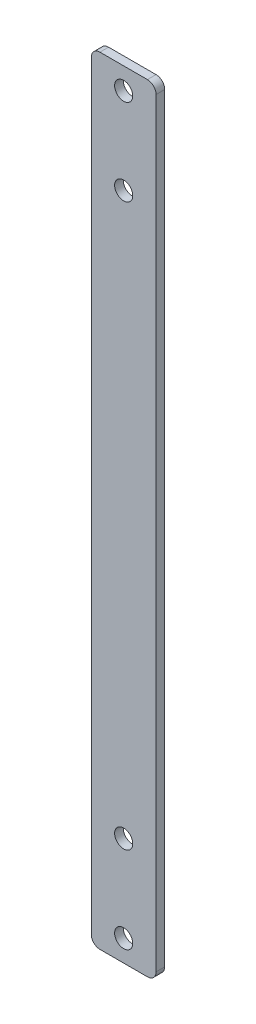
from build123d import *

# Parameters (mm, degrees)
SKETCH_1_R      = 2.1
EXTRUDE_1_DEPTH = 2


with BuildPart() as part:
    # Эскиз1 → Бобышка-Вытянуть1 (new body)
    with BuildSketch(Plane.XY):
        with BuildLine():
            Line((-7.5, 173), (-7.5, -3))
            ThreePointArc((-7.5, -3), (-6.914213562, -4.414213562), (-5.5, -5))
            Line((-5.5, -5), (5.5, -5))
            ThreePointArc((5.5, -5), (6.914213562, -4.414213562), (7.5, -3))
            Line((7.5, -3), (7.5, 173))
            ThreePointArc((7.5, 173), (6.914213562, 174.414213562), (5.5, 175))
            Line((5.5, 175), (-5.5, 175))
            ThreePointArc((-5.5, 175), (-6.914213562, 174.414213562), (-7.5, 173))
        make_face()
        with Locations((0, 170)):
            Circle(SKETCH_1_R, mode=Mode.SUBTRACT)
        with Locations((0, 150)):
            Circle(SKETCH_1_R, mode=Mode.SUBTRACT)
        with Locations((0, 20)):
            Circle(SKETCH_1_R, mode=Mode.SUBTRACT)
        Circle(SKETCH_1_R, mode=Mode.SUBTRACT)
    extrude(amount=EXTRUDE_1_DEPTH)


solid = part.part
